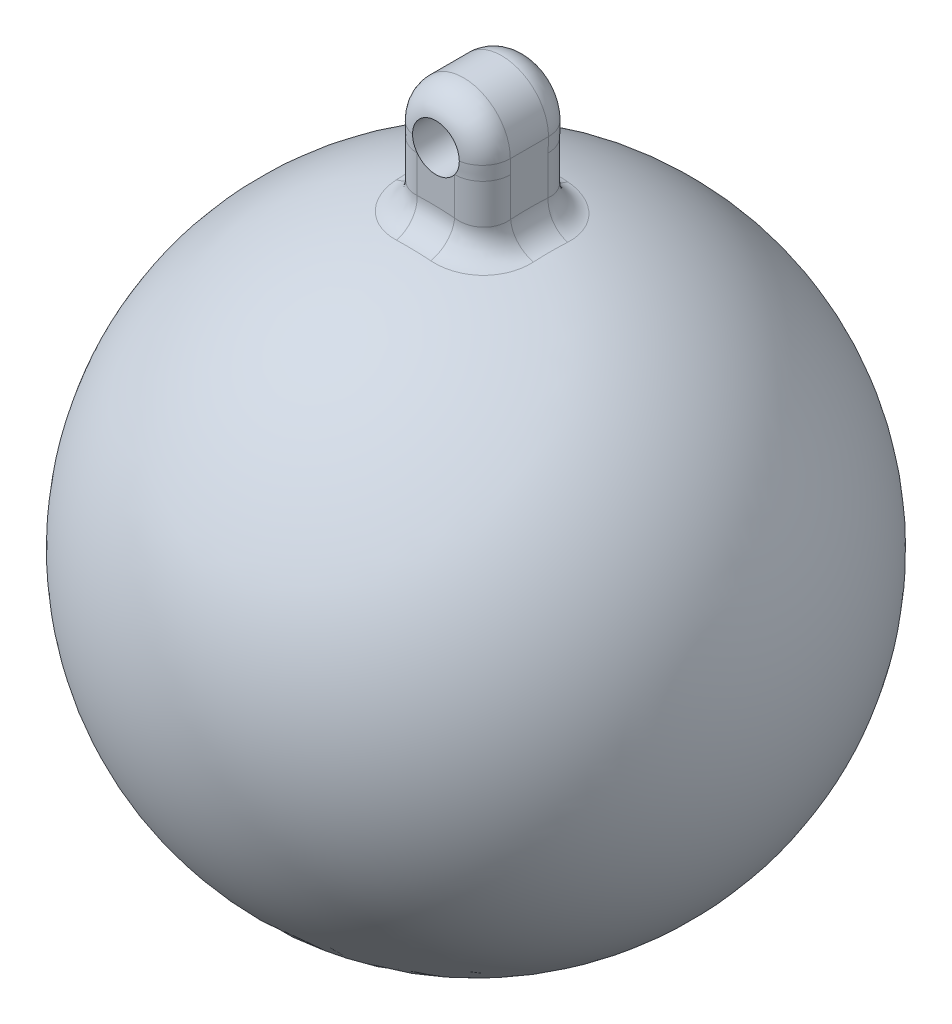
from build123d import *

# Parameters (mm, degrees)
BOSS_EXTRUDE1_DEPTH = 5
SKETCH3_R           = 2.5
CUT_EXTRUDE1_DEPTH  = 10
FILLET7_R           = 3


with BuildPart() as part:
    # Sketch1 → Revolve1 (revolve)
    with BuildSketch(Plane(origin=(0, 0, 0), x_dir=(1, 0, 0), z_dir=(0, 1, 0))):
        with BuildLine():
            Line((-32.5, 0), (32.5, 0))
            ThreePointArc((32.5, 0), (0, -32.5), (-32.5, 0))
        make_face()
    revolve(axis=Axis((-32.5, 0, 0), (1, 0, 0)))

    # Sketch2 → Boss-Extrude1 (add, symmetric)
    with BuildSketch(Plane.XY):
        with BuildLine():
            Line((-4.287633392, 40), (-4.287633392, 25))
            Line((-4.287633392, 25), (5.712366608, 25))
            Line((5.712366608, 25), (5.712366608, 40))
            ThreePointArc((5.712366608, 40), (0.712366608, 45), (-4.287633392, 40))
        make_face()
    extrude(amount=BOSS_EXTRUDE1_DEPTH, both=True)

    # Sketch3 → Cut-Extrude1 (cut)
    with BuildSketch(Plane.XY.offset(5)):
        with Locations((0.712366608, 40)):
            Circle(SKETCH3_R)
    extrude(amount=-CUT_EXTRUDE1_DEPTH, mode=Mode.SUBTRACT)

    # Fillet7
    fillet7_edges = [part.edges().sort_by_distance(p)[0] for p in [
        (-4.287633392, 32.21593084, 0),
        (5.712366608, 31.994044254, 0),
        (-4.287633392, 35.912779455, -5),
        (5.712366608, 35.800465719, -5),
        (-4.287633392, 35.912779455, 5),
        (5.712366608, 35.800465719, 5),
        (0.72116611, 32.104982782, -5),
        (0.72116611, 32.104982782, 5),
    ]]
    fillet(fillet7_edges, radius=FILLET7_R)


solid = part.part
